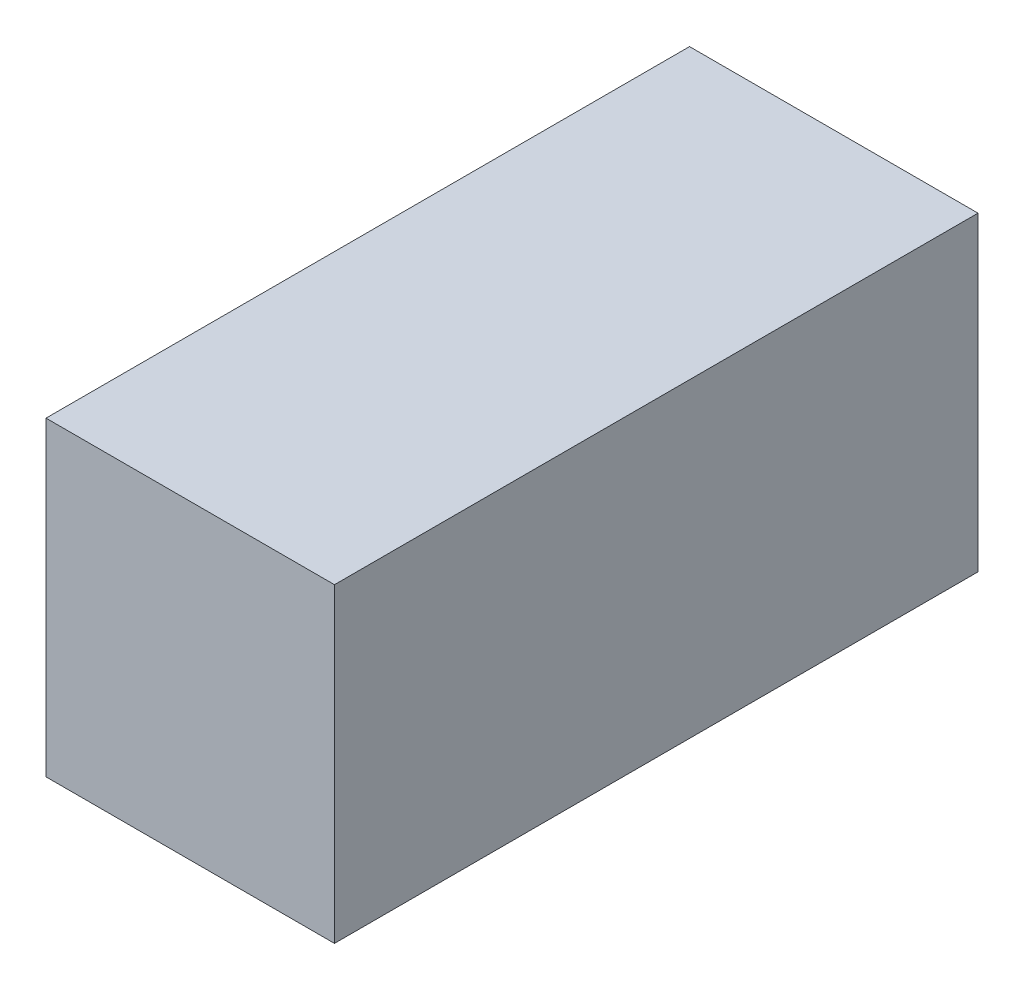
from build123d import *

# Parameters (mm, degrees)
SKETCH1_W           = 78
SKETCH1_H           = 84
BOSS_EXTRUDE1_DEPTH = 174


with BuildPart() as part:
    # Sketch1 → Boss-Extrude1 (new body)
    with BuildSketch(Plane.XY):
        with Locations((8.501868923, 3.348604528)):
            Rectangle(SKETCH1_W, SKETCH1_H)
    extrude(amount=BOSS_EXTRUDE1_DEPTH)


solid = part.part
